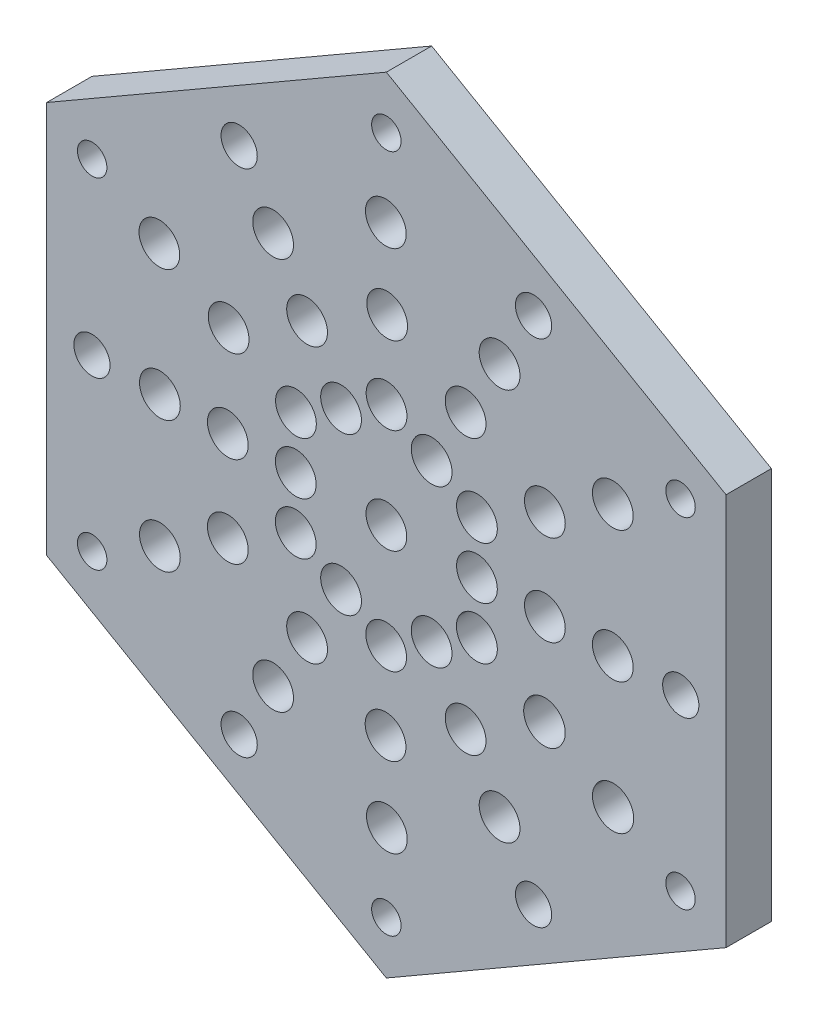
from build123d import *

# Parameters (mm, degrees)
SKETCH1_R           = 4
SKETCH1_R_2         = 3.25
SKETCH1_R_3         = 4.5
BOSS_EXTRUDE1_DEPTH = 10


with BuildPart() as part:
    # Sketch1 → Boss-Extrude1 (new body)
    with BuildSketch(Plane.XY):
        Polygon((-75, -43.301270189), (0, -86.602540378), (75, -43.301270189), (75, 43.301270189), (0, 86.602540378), (-75, 43.301270189), align=None)
        with Locations((-32.5, -56.291651246)):
            Circle(SKETCH1_R, mode=Mode.SUBTRACT)
        with Locations((-64.951905284, -37.5)):
            Circle(SKETCH1_R_2, mode=Mode.SUBTRACT)
        with Locations((-50, -29)):
            Circle(SKETCH1_R_3, mode=Mode.SUBTRACT)
        with Locations((-65, 0)):
            Circle(SKETCH1_R, mode=Mode.SUBTRACT)
        with Locations((-25, -43.301270189)):
            Circle(SKETCH1_R_3, mode=Mode.SUBTRACT)
        with Locations((-0.179491924, -40.310889132)):
            Circle(SKETCH1_R_3, mode=Mode.SUBTRACT)
        with Locations((-17.5, -30.310889132)):
            Circle(SKETCH1_R_3, mode=Mode.SUBTRACT)
        with Locations((-0.040707856, -23.070508076)):
            Circle(SKETCH1_R_3, mode=Mode.SUBTRACT)
        with Locations((-35, -20)):
            Circle(SKETCH1_R_3, mode=Mode.SUBTRACT)
        with Locations((-20, -11.5)):
            Circle(SKETCH1_R_3, mode=Mode.SUBTRACT)
        with Locations((-10, -17.320508076)):
            Circle(SKETCH1_R_3, mode=Mode.SUBTRACT)
        with Locations((0, -75)):
            Circle(SKETCH1_R_2, mode=Mode.SUBTRACT)
        with Locations((0.11473671, -57.801270189)):
            Circle(SKETCH1_R_3, mode=Mode.SUBTRACT)
        with Locations((32.5, -56.291651246)):
            Circle(SKETCH1_R, mode=Mode.SUBTRACT)
        with Locations((25, -43.301270189)):
            Circle(SKETCH1_R_3, mode=Mode.SUBTRACT)
        with Locations((17.5, -30.310889132)):
            Circle(SKETCH1_R_3, mode=Mode.SUBTRACT)
        with Locations((10, -17.320508076)):
            Circle(SKETCH1_R_3, mode=Mode.SUBTRACT)
        with BuildLine():
            ThreePointArc((16.082691215, -9.285346102), (21.145013203, -7.148110208), (24.5, -11.5))
            ThreePointArc((24.5, -11.5), (24.341353716, -12.684334375), (23.876600928, -13.785161973))
            ThreePointArc((23.876600928, -13.785161973), (17.709292144, -15.467622393), (16.082691215, -9.285346102))
        make_face(mode=Mode.SUBTRACT)
        with BuildLine():
            ThreePointArc((31.016241071, -17.907235132), (36.077748769, -15.630966058), (39.5, -20))
            ThreePointArc((39.5, -20), (39.322568769, -21.251159158), (38.804267005, -22.403654001))
            ThreePointArc((38.804267005, -22.403654001), (32.570508076, -24.208003449), (31.016241071, -17.907235132))
        make_face(mode=Mode.SUBTRACT)
        with BuildLine():
            ThreePointArc((53.95321571, -31.149903614), (47.75, -32.897114317), (46.161521, -26.651366575))
            ThreePointArc((46.161521, -26.651366575), (51.223909668, -24.440108034), (54.61473671, -28.801270189))
            ThreePointArc((54.61473671, -28.801270189), (54.446200406, -30.021279308), (53.95321571, -31.149903614))
        make_face(mode=Mode.SUBTRACT)
        with Locations((64.951905284, -37.5)):
            Circle(SKETCH1_R_2, mode=Mode.SUBTRACT)
        with Locations((-50, 0)):
            Circle(SKETCH1_R_3, mode=Mode.SUBTRACT)
        with Locations((-64.951905284, 37.5)):
            Circle(SKETCH1_R_2, mode=Mode.SUBTRACT)
        with Locations((-50.11473671, 28.801270189)):
            Circle(SKETCH1_R_3, mode=Mode.SUBTRACT)
        with Locations((-35, 0)):
            Circle(SKETCH1_R_3, mode=Mode.SUBTRACT)
        with Locations((-20, 0)):
            Circle(SKETCH1_R_3, mode=Mode.SUBTRACT)
        with Locations((-34.820508076, 20.310889132)):
            Circle(SKETCH1_R_3, mode=Mode.SUBTRACT)
        with Locations((-19.959292144, 11.570508076)):
            Circle(SKETCH1_R_3, mode=Mode.SUBTRACT)
        with Locations((-10, 17.320508076)):
            Circle(SKETCH1_R_3, mode=Mode.SUBTRACT)
        with Locations((-17.5, 30.310889132)):
            Circle(SKETCH1_R_3, mode=Mode.SUBTRACT)
        with Locations((-25, 43.301270189)):
            Circle(SKETCH1_R_3, mode=Mode.SUBTRACT)
        with Locations((-32.5, 56.291651246)):
            Circle(SKETCH1_R, mode=Mode.SUBTRACT)
        with Locations((-0.11473671, 57.801270189)):
            Circle(SKETCH1_R_3, mode=Mode.SUBTRACT)
        Circle(SKETCH1_R_3, mode=Mode.SUBTRACT)
        with Locations((10, 17.320508076)):
            Circle(SKETCH1_R_3, mode=Mode.SUBTRACT)
        with Locations((20, 0)):
            Circle(SKETCH1_R_3, mode=Mode.SUBTRACT)
        with Locations((35, 0)):
            Circle(SKETCH1_R_3, mode=Mode.SUBTRACT)
        with Locations((20, 11.5)):
            Circle(SKETCH1_R_3, mode=Mode.SUBTRACT)
        with Locations((35, 20)):
            Circle(SKETCH1_R_3, mode=Mode.SUBTRACT)
        with Locations((0.040707856, 23.070508076)):
            Circle(SKETCH1_R_3, mode=Mode.SUBTRACT)
        with Locations((17.5, 30.310889132)):
            Circle(SKETCH1_R_3, mode=Mode.SUBTRACT)
        with Locations((0.179491924, 40.310889132)):
            Circle(SKETCH1_R_3, mode=Mode.SUBTRACT)
        with Locations((25, 43.301270189)):
            Circle(SKETCH1_R_3, mode=Mode.SUBTRACT)
        with Locations((50, 0)):
            Circle(SKETCH1_R_3, mode=Mode.SUBTRACT)
        with Locations((65, 0)):
            Circle(SKETCH1_R, mode=Mode.SUBTRACT)
        with Locations((50, 29)):
            Circle(SKETCH1_R_3, mode=Mode.SUBTRACT)
        with Locations((64.951905284, 37.5)):
            Circle(SKETCH1_R_2, mode=Mode.SUBTRACT)
        with Locations((32.5, 56.291651246)):
            Circle(SKETCH1_R, mode=Mode.SUBTRACT)
        with Locations((0, 75)):
            Circle(SKETCH1_R_2, mode=Mode.SUBTRACT)
    extrude(amount=BOSS_EXTRUDE1_DEPTH)


solid = part.part
